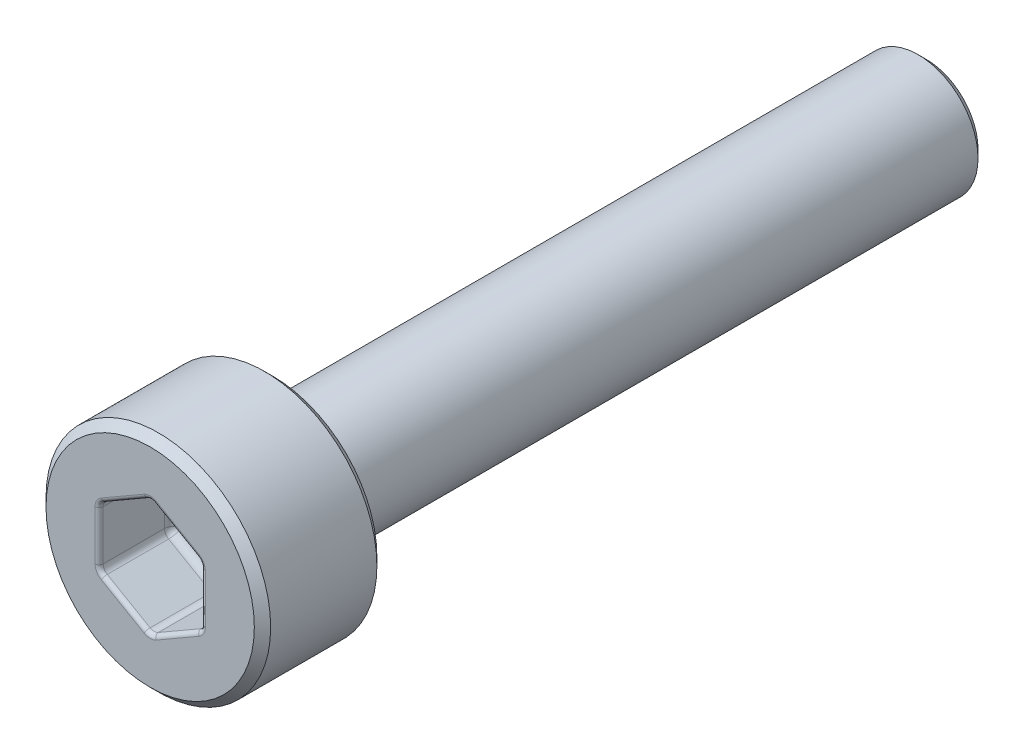
from build123d import *

# Parameters (mm, degrees)
SCHNITT_LINEAR_AUSTRAGEN1_DEPTH = 1.8
FASE1_SIZE                      = 0.2
VERRUNDUNG1_R                   = 0.2
VERRUNDUNG2_R                   = 0.1


with BuildPart() as part:
    # Skizze1 → Rotation1 (revolve)
    with BuildSketch(Plane(origin=(0, 0, 0), x_dir=(0, 0, -1), z_dir=(1, 0, 0))):
        Polygon((-3, 0), (-3, 2.75), (0, 2.75), (0, 1.465), (16, 1.465), (16, 0), align=None)
    revolve(axis=Axis((0, 0, 21.919879518), (0, 0, -1)))

    # Skizze2 → Schnitt-Linear austragen1 (cut)
    with BuildSketch(Plane.XY.offset(3)):
        Polygon((1.25, -0.721687836), (1.25, 0.721687836), (0, 1.443375673), (-1.25, 0.721687836), (-1.25, -0.721687836), (0, -1.443375673), align=None)
    extrude(amount=-SCHNITT_LINEAR_AUSTRAGEN1_DEPTH, mode=Mode.SUBTRACT)

    # Fase1
    fase1_edges = [part.edges().sort_by_distance(p)[0] for p in [
        (0, -2.75, 3),
        (0, -2.75, 0),
        (0, -1.465, -16),
    ]]
    chamfer(fase1_edges, length=FASE1_SIZE)

    # Verrundung1
    verrundung1_edges = [part.edges().sort_by_distance(p)[0] for p in [
        (-0.625, -1.082531755, 1.2),
        (-1.25, 0, 1.2),
        (-0.625, 1.082531755, 1.2),
        (0.625, 1.082531755, 1.2),
        (1.25, 0, 1.2),
        (0.625, -1.082531755, 1.2),
        (-1.25, -0.721687836, 2.1),
        (0, -1.443375673, 2.1),
        (1.25, -0.721687836, 2.1),
        (1.25, 0.721687836, 2.1),
        (0, 1.443375673, 2.1),
        (-1.25, 0.721687836, 2.1),
        (0, -1.465, 0),
    ]]
    fillet(verrundung1_edges, radius=VERRUNDUNG1_R)

    # Verrundung2
    verrundung2_edges = [part.edges().sort_by_distance(p)[0] for p in [
        (1.223205081, -0.706217783, 3),
        (0.625, -1.082531755, 3),
        (0, -1.412435565, 3),
        (-0.625, -1.082531755, 3),
        (-1.223205081, -0.706217783, 3),
        (-1.25, 0, 3),
        (-1.223205081, 0.706217783, 3),
        (-0.625, 1.082531755, 3),
        (0, 1.412435565, 3),
        (0.625, 1.082531755, 3),
        (1.223205081, 0.706217783, 3),
        (1.25, 0, 3),
    ]]
    fillet(verrundung2_edges, radius=VERRUNDUNG2_R)


solid = part.part
